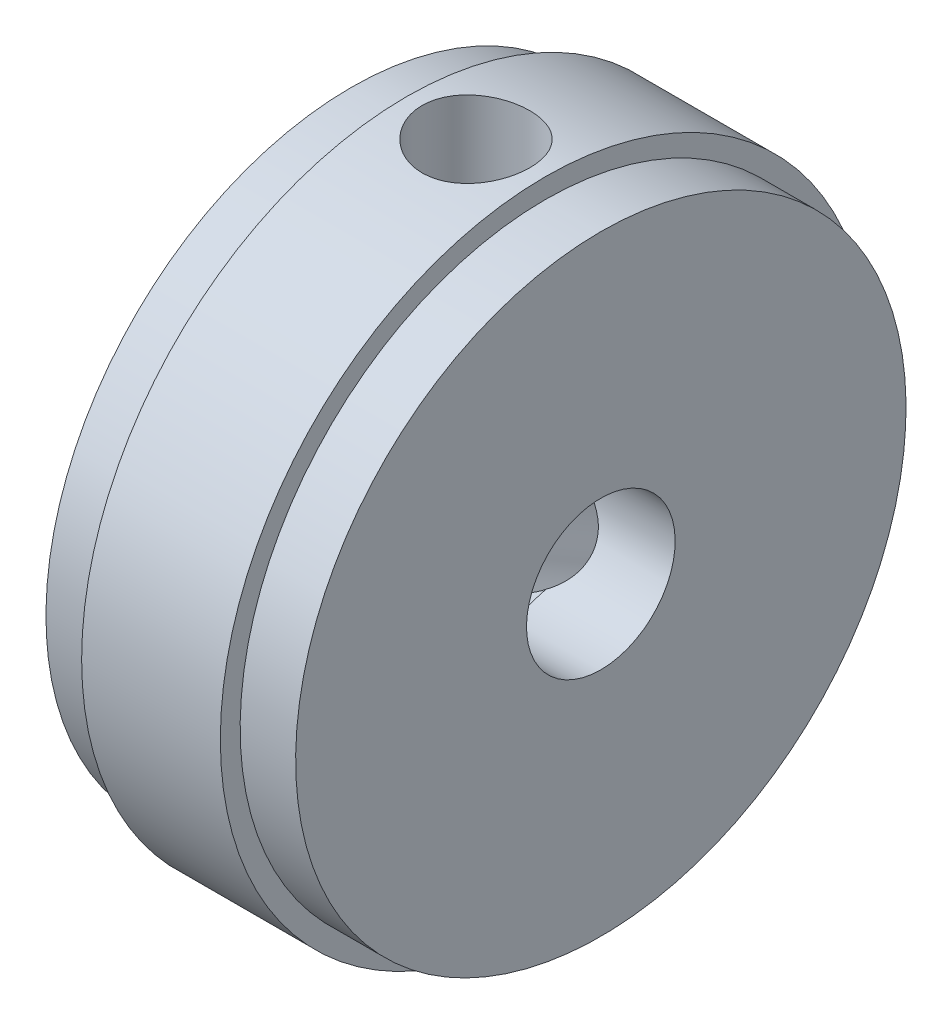
from build123d import *

# Parameters (mm, degrees)
SKETCH2_R          = 2.38125
CUT_EXTRUDE1_DEPTH = 17.760154892
CIRPATTERN1_COUNT  = 2
CIRPATTERN1_ANGLE  = 120


with BuildPart() as part:
    # Sketch1 → Revolve1 (revolve)
    with BuildSketch(Plane.XY):
        Polygon((4, 0), (-4, 0), (-4, 9.779), (-2.222, 9.779), (-2.222, 10.414), (2.222, 10.414), (2.222, 9.779), (4, 9.779), align=None)
    revolve(axis=Axis((8.430806561, 0, 0), (-1, 0, 0)))

    # Sketch2 → Cut-Extrude1 (cut, through all)
    with BuildSketch(Plane.ZY.offset(4)):
        with Locations(Location((0, 0, 0), (0, 0, 270))):
            Circle(SKETCH2_R)
    extrude(amount=-CUT_EXTRUDE1_DEPTH, mode=Mode.SUBTRACT)

    # Sketch4 → #8-32 Tapped Hole1 (revolve, cut)
    with BuildSketch(Plane(origin=(0, 10.414, 0), x_dir=(0, 0, 1), z_dir=(1, 0, 0))):
        Polygon((0, 0), (0, 13.483806461), (1.7272, 12.446), (1.7272, 0), align=None)
    f_8_32_tapped_hole1 = revolve(axis=Axis((0, 16.764, 0), (0, -1, 0)), mode=Mode.SUBTRACT)

    # CirPattern1: #8-32 Tapped Hole1 ×2 about axis
    cirpattern1_axis = Axis((4, 0, 0), (-1, 0, 0))
    for i in range(1, CIRPATTERN1_COUNT):
        add(f_8_32_tapped_hole1.rotate(cirpattern1_axis, i * CIRPATTERN1_ANGLE / (CIRPATTERN1_COUNT - 1)), mode=Mode.SUBTRACT)


solid = part.part
